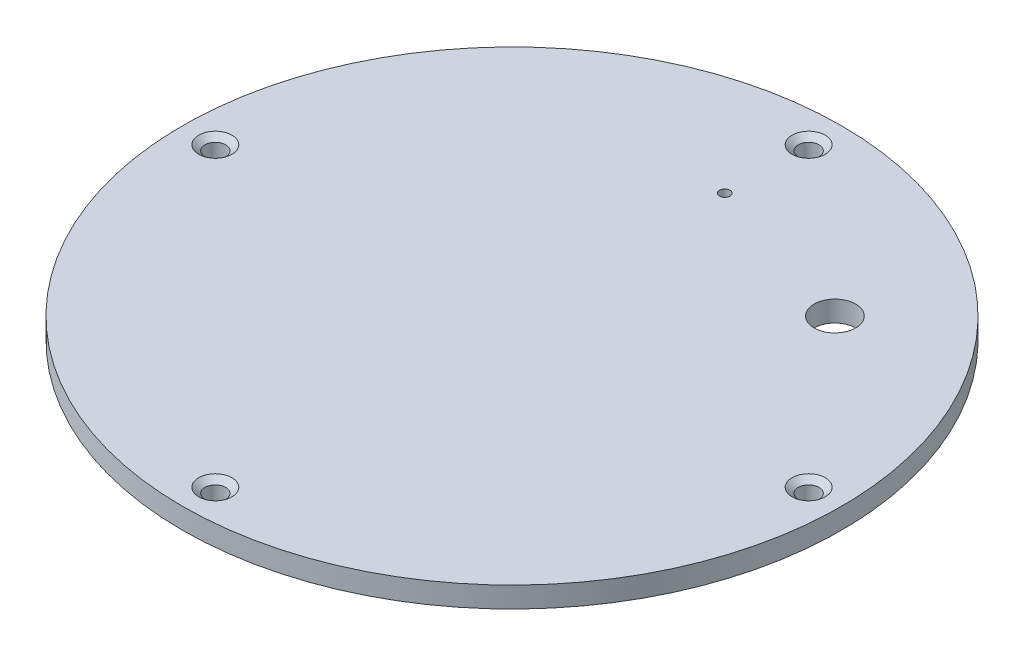
from build123d import *

# Parameters (mm, degrees)
SKETCH1_R                                       = 15.875
BOSS_EXTRUDE1_DEPTH                             = 1
CUT_EXTRUDE1_DEPTH                              = 23.472900347
CUT_EXTRUDE1_DEPTH_BACK                         = 23.472900347
SKETCH6_R                                       = 0.25
SKETCH6_R_2                                     = 1
CSK_FOR_M2_FLAT_HEAD_MACHINE_SCREW1_D           = 1
CSK_FOR_M2_FLAT_HEAD_MACHINE_SCREW1_CSINK_D     = 1.6
CSK_FOR_M2_FLAT_HEAD_MACHINE_SCREW1_CSINK_ANGLE = 100


with BuildPart() as part:
    # Sketch1 → Boss-Extrude1 (new body)
    with BuildSketch(Plane(origin=(0, 0, 0), x_dir=(1, 0, 0), z_dir=(0, 1, 0))):
        with Locations(Location((0, 0, 0), (0, 0, 270))):
            Circle(SKETCH1_R)
    extrude(amount=BOSS_EXTRUDE1_DEPTH)

    # Sketch6 → Cut-Extrude1 (cut, two sides: drawn at the far end of the back side and taken through both)
    with BuildSketch(Plane(origin=(0, 1, 0), x_dir=(1, 0, 0), z_dir=(0, 1, 0)).offset(-CUT_EXTRUDE1_DEPTH_BACK)):
        with Locations(Location((0, 10.25, 0), (0, 0, 270))):
            Circle(SKETCH6_R)
        with Locations(Location((7.778174593, 7.778174593, 0), (0, 0, 270))):
            Circle(SKETCH6_R_2)
    extrude(amount=CUT_EXTRUDE1_DEPTH + CUT_EXTRUDE1_DEPTH_BACK, mode=Mode.SUBTRACT)

    # CSK for M2 Flat Head Machine Screw1 (through all)
    with Locations(Plane(origin=(0, 1, 0), x_dir=(1, 0, 0), z_dir=(0, 1, 0))):
        with Locations((0, 14.29), (-14.29, 0), (0, -14.29), (14.29, 0)):
            CounterSinkHole(CSK_FOR_M2_FLAT_HEAD_MACHINE_SCREW1_D / 2, CSK_FOR_M2_FLAT_HEAD_MACHINE_SCREW1_CSINK_D / 2, counter_sink_angle=CSK_FOR_M2_FLAT_HEAD_MACHINE_SCREW1_CSINK_ANGLE)


solid = part.part
